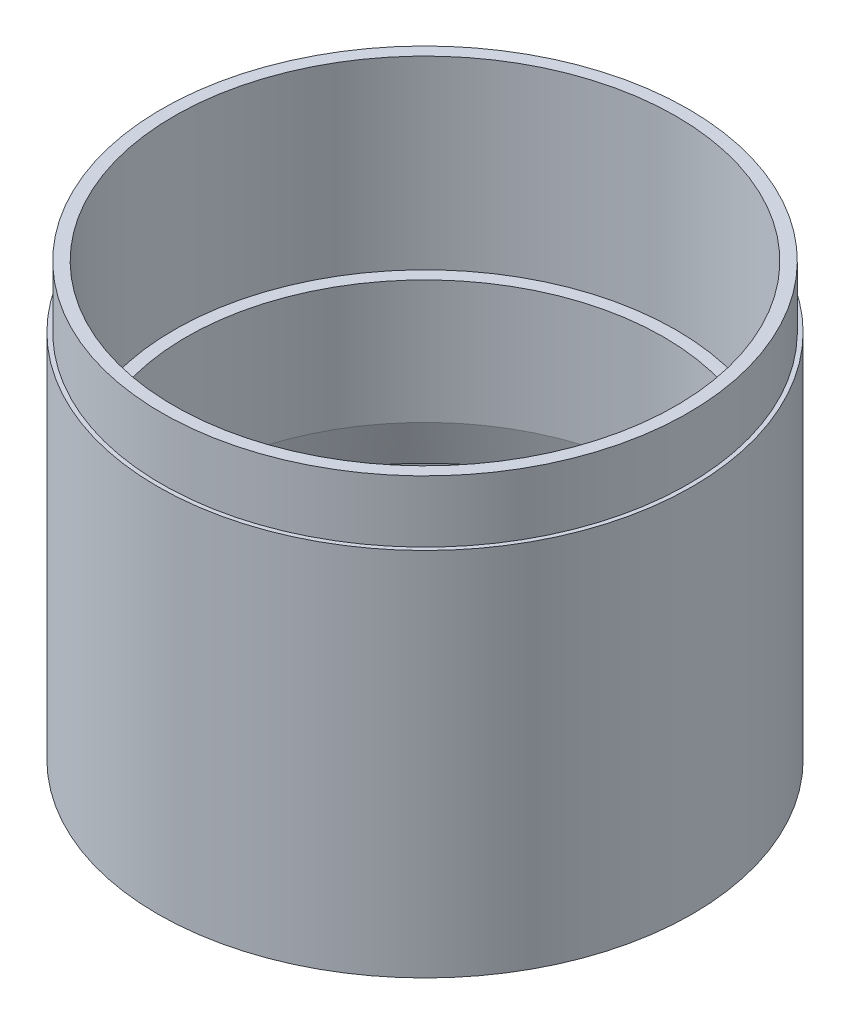
from build123d import *

# Parameters (mm, degrees)
SZKIC1_W = 3
SZKIC1_H = 15


with BuildPart() as part:
    # Szkic1 → Obrót1 (revolve)
    with BuildSketch(Plane.XY, mode=Mode.PRIVATE) as obr_t1_sk:
        Polygon((-65, 0), (-62, 0), (-62, 20), (-60, 20), (-58, 30), (-58, 60), (-61, 60), (-61, 90), (-64, 90), (-65, 90), (-65, 20), align=None)
        with Locations((-62.5, 97.5)):
            Rectangle(SZKIC1_W, SZKIC1_H)
    revolve(obr_t1_sk.sketch.rotate(Axis((0, 0, 0), (0, 1, 0)), 270), axis=Axis((0, 0, 0), (0, 1, 0)))


solid = part.part
